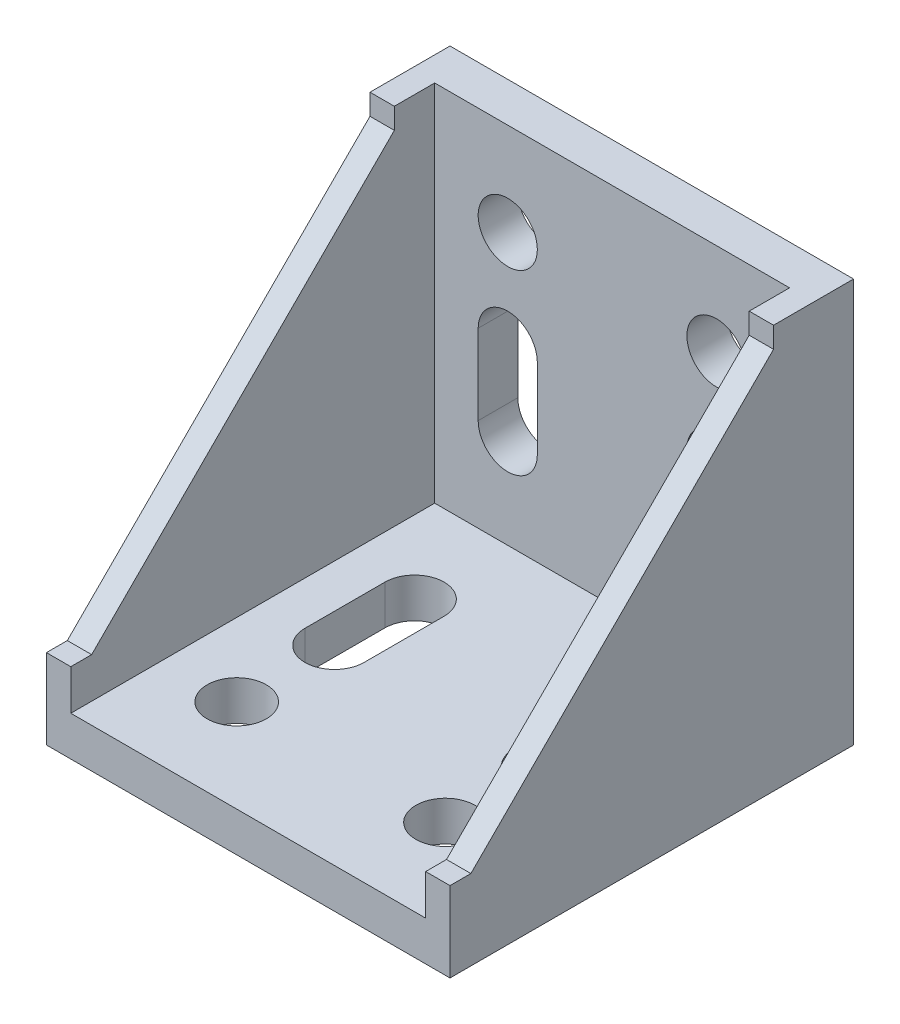
from build123d import *

# Parameters (mm, degrees)
SKETCH_1_W               = 58
SKETCH_1_H               = 58
EXTRUDE_1_DEPTH          = 5.7
SKETCH_2_W               = 58
SKETCH_2_H               = 5.7
EXTRUDE_2_DEPTH          = 58
EXTRUDE_3_DEPTH          = 3.5
SKETCH_4_R               = 4.25
CUT_EXTRUDE_1_DEPTH      = 67.462696304
MIRROR_2_COPY_1_DEPTH    = 3.5
MIRROR_2_COPY_2_SKETCH_R = 4.25
MIRROR_2_COPY_2_DEPTH    = 67.462696304
MIRROR_2_COPY_3_DEPTH    = 3.5


with BuildPart() as part:
    # 草图1 → 凸台-拉伸1 (new body)
    with BuildSketch(Plane.XY):
        Rectangle(SKETCH_1_W, SKETCH_1_H)
    extrude(amount=EXTRUDE_1_DEPTH)

    # 草图2 → 凸台-拉伸2 (add)
    with BuildSketch(Plane(origin=(0, 0, 0), x_dir=(-1, 0, 0), z_dir=(0, 0, -1))):
        with Locations((0, -26.15)):
            Rectangle(SKETCH_2_W, SKETCH_2_H)
    extrude(amount=-EXTRUDE_2_DEPTH)

    # 草图3 → 凸台-拉伸3 (add)
    with BuildSketch(Plane.ZY.offset(29)):
        Polygon((5.7, 29), (11.5, 29), (11.5, 26), (55, -17.5), (58, -17.5), (58, -23.3), (5.7, -23.3), align=None)
    extrude_3 = extrude(amount=-EXTRUDE_3_DEPTH)

    # 草图4 → 切除-拉伸1 (cut, through all)
    with BuildSketch(Plane.XY.offset(5.7)):
        with Locations((-15, 15.651970491)):
            Circle(SKETCH_4_R)
        with BuildLine():
            Line((-19.25, -9.900882272), (-19.25, 1.599117728))
            ThreePointArc((-19.25, 1.599117728), (-15, 5.849117728), (-10.75, 1.599117728))
            Line((-10.75, 1.599117728), (-10.75, -9.900882272))
            ThreePointArc((-10.75, -9.900882272), (-15, -14.150882272), (-19.25, -9.900882272))
        make_face()
    cut_extrude_1 = extrude(amount=-CUT_EXTRUDE_1_DEPTH, mode=Mode.SUBTRACT)

    # 镜向1: 凸台-拉伸3, 切除-拉伸1 across plane
    add(extrude_3.mirror(Plane(origin=(0, 0, 0), x_dir=(0, 0, 1), z_dir=(1, 0, 0))))
    add(cut_extrude_1.mirror(Plane(origin=(0, 0, 0), x_dir=(0, 0, 1), z_dir=(1, 0, 0))), mode=Mode.SUBTRACT)

    # 镜向2: 切除-拉伸1 across plane
    add(cut_extrude_1.mirror(Plane(origin=(0, -14.5, 14.5), x_dir=(0, 0.7071067811865478, 0.7071067811865472), z_dir=(0, -0.7071067811865475, 0.7071067811865477))), mode=Mode.SUBTRACT)

    # 镜向2 copy 1 sketch → 镜向2 copy 1 (add)
    with BuildSketch(Plane(origin=(29, -29, 29), x_dir=(0, 1, 0), z_dir=(1, 0, 0))):
        Polygon((5.7, 29), (11.5, 29), (11.5, 26), (55, -17.5), (58, -17.5), (58, -23.3), (5.7, -23.3), align=None)
    extrude(amount=-MIRROR_2_COPY_1_DEPTH)

    # 镜向2 copy 2 sketch → 镜向2 copy 2 (cut, through all)
    with BuildSketch(Plane(origin=(0, -23.3, 29), x_dir=(-1, 0, 0), z_dir=(0, 1, 0))):
        with Locations((-15, 15.651970491)):
            Circle(MIRROR_2_COPY_2_SKETCH_R)
        with BuildLine():
            Line((-19.25, -9.900882272), (-19.25, 1.599117728))
            ThreePointArc((-19.25, 1.599117728), (-15, 5.849117728), (-10.75, 1.599117728))
            Line((-10.75, 1.599117728), (-10.75, -9.900882272))
            ThreePointArc((-10.75, -9.900882272), (-15, -14.150882272), (-19.25, -9.900882272))
        make_face()
    extrude(amount=-MIRROR_2_COPY_2_DEPTH, mode=Mode.SUBTRACT)

    # 镜向2 copy 3 sketch → 镜向2 copy 3 (add)
    with BuildSketch(Plane(origin=(-29, -29, 29), x_dir=(0, 1, 0), z_dir=(-1, 0, 0))):
        Polygon((5.7, -29), (11.5, -29), (11.5, -26), (55, 17.5), (58, 17.5), (58, 23.3), (5.7, 23.3), align=None)
    extrude(amount=-MIRROR_2_COPY_3_DEPTH)


solid = part.part
